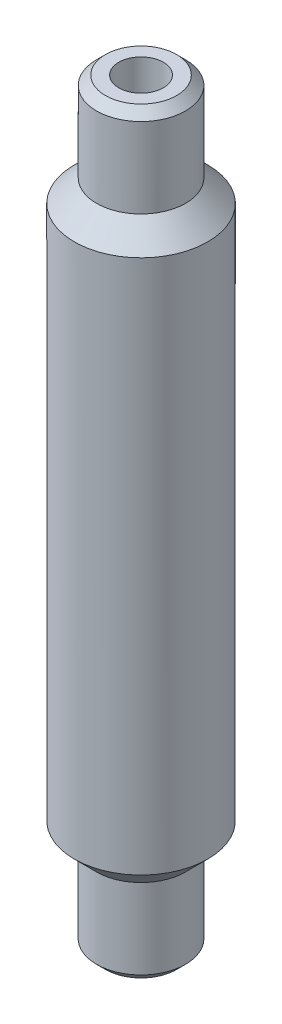
from build123d import *

# Parameters (mm, degrees)
SKETCH1_R           = 9.525
SKETCH1_R_2         = 3.175
SKETCH1_R_3         = 6.35
BOSS_EXTRUDE1_DEPTH = 82.69732
CHAMFER1_SIZE       = 3.175
BOSS_EXTRUDE2_START = -12.7
SKETCH1_3_R         = 6.35
SKETCH1_3_R_2       = 3.175
BOSS_EXTRUDE2_DEPTH = 12.7
BOSS_EXTRUDE3_START = 82.69732
SKETCH1_4_R         = 6.35
SKETCH1_4_R_2       = 3.175
BOSS_EXTRUDE3_DEPTH = 12.7
CHAMFER2_SIZE       = 1.27


with BuildPart() as part:
    # Sketch1 → Boss-Extrude1 (new body)
    # profile 1 of 2: a face of its own
    with BuildSketch(Plane(origin=(0, 0, 0), x_dir=(1, 0, 0), z_dir=(0, 1, 0))):
        with Locations(Location((0, 0, 0), (0, 0, 270))):
            Circle(SKETCH1_R)
        with Locations(Location((0, 0, 0), (0, 0, 270))):
            Circle(SKETCH1_R_2, mode=Mode.SUBTRACT)
    # profile 2 of 2: a face of its own
    with BuildSketch(Plane(origin=(0, 0, 0), x_dir=(1, 0, 0), z_dir=(0, 1, 0))):
        Circle(SKETCH1_R_3)
        with Locations(Location((0, 0, 0), (0, 0, 270))):
            Circle(SKETCH1_R_2, mode=Mode.SUBTRACT)
    extrude(amount=BOSS_EXTRUDE1_DEPTH)

    # Chamfer1
    chamfer1_edges = [part.edges().sort_by_distance(p)[0] for p in [
        (0, 0, -9.525),
        (0, 82.69732, -9.525),
    ]]
    chamfer(chamfer1_edges, length=CHAMFER1_SIZE)

    # Sketch1<3> → Boss-Extrude2 (add)
    with BuildSketch(Plane(origin=(0, 0, 0), x_dir=(1, 0, 0), z_dir=(0, 1, 0)).offset(BOSS_EXTRUDE2_START)):
        with Locations(Location((0, 0, 0), (0, 0, 270))):
            Circle(SKETCH1_3_R)
        with Locations(Location((0, 0, 0), (0, 0, 270))):
            Circle(SKETCH1_3_R_2, mode=Mode.SUBTRACT)
    extrude(amount=BOSS_EXTRUDE2_DEPTH)

    # Sketch1<4> → Boss-Extrude3 (add)
    with BuildSketch(Plane(origin=(0, 0, 0), x_dir=(1, 0, 0), z_dir=(0, 1, 0)).offset(BOSS_EXTRUDE3_START)):
        with Locations(Location((0, 0, 0), (0, 0, 270))):
            Circle(SKETCH1_4_R)
        with Locations(Location((0, 0, 0), (0, 0, 270))):
            Circle(SKETCH1_4_R_2, mode=Mode.SUBTRACT)
    extrude(amount=BOSS_EXTRUDE3_DEPTH)

    # Chamfer2
    chamfer2_edges = [part.edges().sort_by_distance(p)[0] for p in [
        (0, -12.7, -6.35),
        (0, 95.39732, -6.35),
    ]]
    chamfer(chamfer2_edges, length=CHAMFER2_SIZE)


solid = part.part
